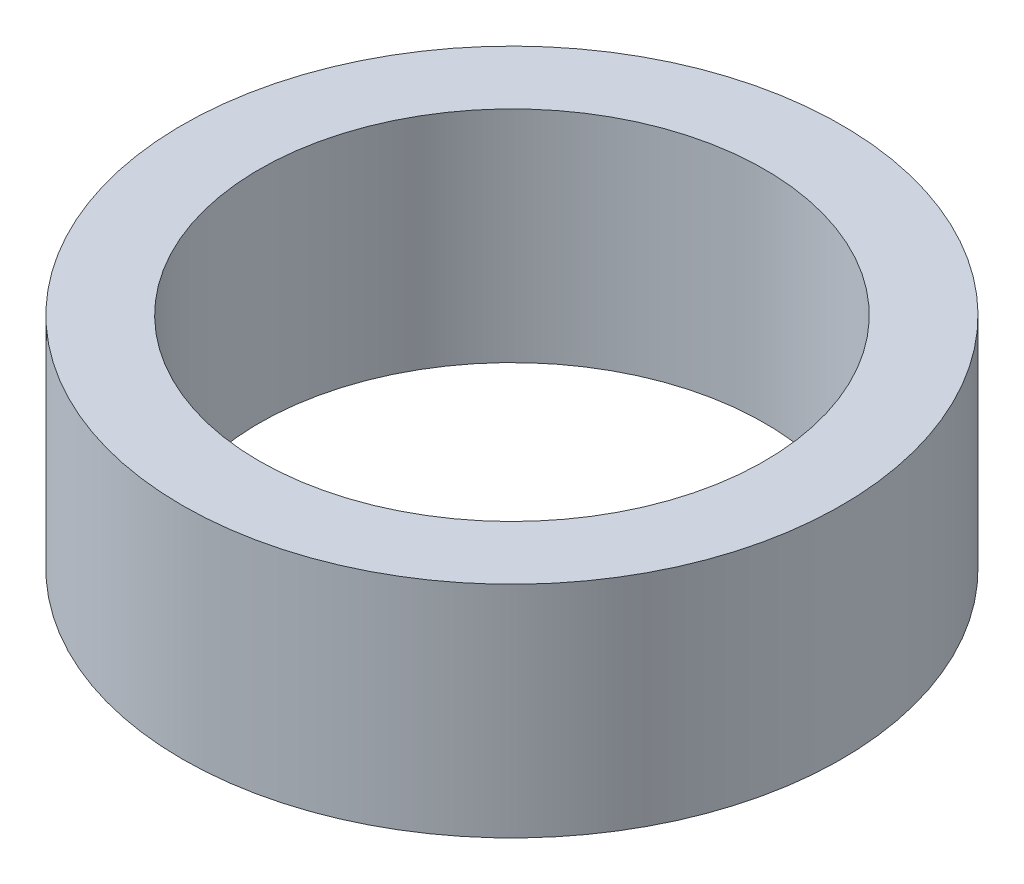
from build123d import *

# Parameters (mm, degrees)
SKETCH1_R           = 19.05
BOSS_EXTRUDE1_DEPTH = 12.7
SKETCH4_R           = 14.605
CUT_EXTRUDE1_DEPTH  = 30.784140075


with BuildPart() as part:
    # Sketch1 → Boss-Extrude1 (new body)
    with BuildSketch(Plane(origin=(0, 0, 0), x_dir=(1, 0, 0), z_dir=(0, 1, 0))):
        with Locations(Location((0, 0, 0), (0, 0, 270))):
            Circle(SKETCH1_R)
    extrude(amount=BOSS_EXTRUDE1_DEPTH)

    # Sketch4 → Cut-Extrude1 (cut, through all)
    with BuildSketch(Plane(origin=(0, 12.7, 0), x_dir=(1, 0, 0), z_dir=(0, 1, 0))):
        with Locations(Location((0, 0, 0), (0, 0, 270))):
            Circle(SKETCH4_R)
    extrude(amount=-CUT_EXTRUDE1_DEPTH, mode=Mode.SUBTRACT)


solid = part.part
